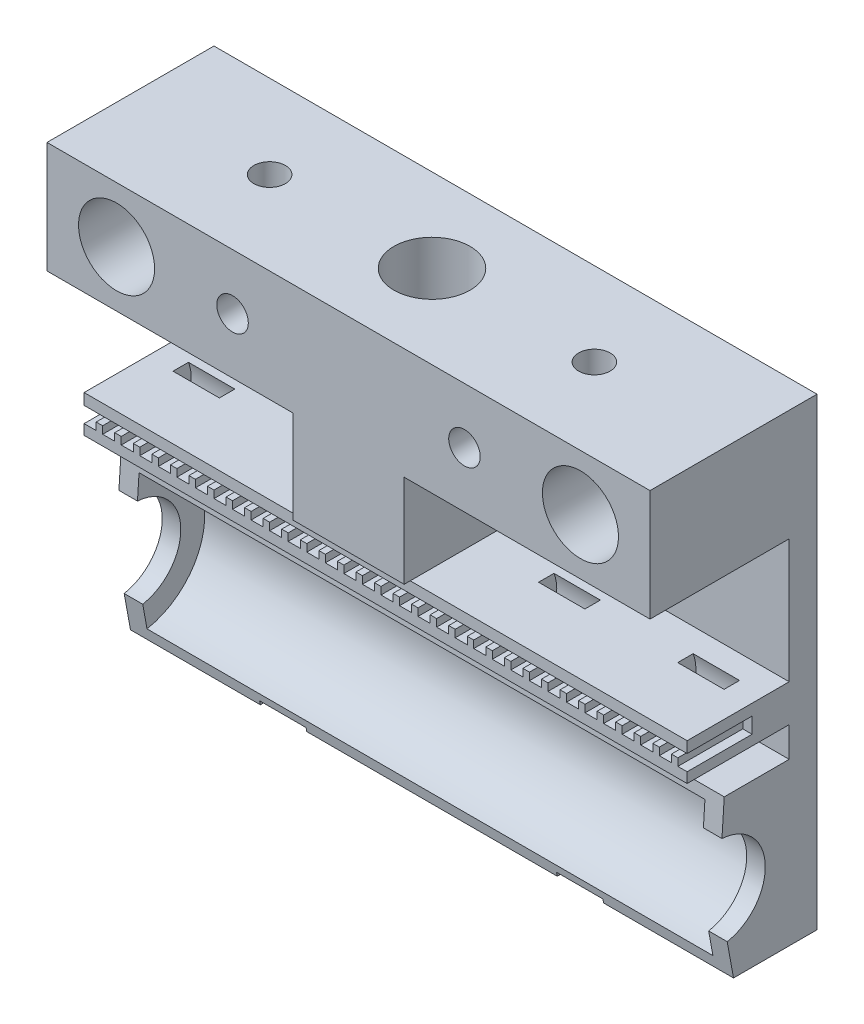
from build123d import *

# Parameters (mm, degrees)
SKIZZE1_W                       = 65
SKIZZE1_H                       = 50
AUFSATZ_LINEAR_AUSTRAGEN1_DEPTH = 3
SKIZZE2_W                       = 65
SKIZZE2_H                       = 12
AUFSATZ_LINEAR_AUSTRAGEN2_DEPTH = 15
SCHNITT_LINEAR_AUSTRAGEN1_REACH = 46.78
SKIZZE3_R                       = 4.1
SKIZZE3_R_2                     = 1.7
SCHNITT_LINEAR_AUSTRAGEN2_DEPTH = 3.5
AUFSATZ_LINEAR_AUSTRAGEN4_DEPTH = 65
AUFSATZ_LINEAR_AUSTRAGEN5_DEPTH = 2
SKIZZE12_W                      = 5
SKIZZE12_H                      = 1.5
SKIZZE14_W                      = 65
SKIZZE14_H                      = 4
AUFSATZ_LINEAR_AUSTRAGEN6_DEPTH = 4
SKIZZE15_W                      = 65
SKIZZE15_H                      = 1.2
SKIZZE15_H_2                    = 1.9
AUFSATZ_LINEAR_AUSTRAGEN7_DEPTH = 7
SCHNITT_LINEAR_AUSTRAGEN4_DEPTH = 7
SCHNITT_LINEAR_AUSTRAGEN5_REACH = 64.292
SKIZZE18_R                      = 1.7
SCHNITT_LINEAR_AUSTRAGEN6_DEPTH = 3.5
SKIZZE22_W                      = 5
SKIZZE22_H                      = 1.5
SCHNITT_ROTATION2_ANGLE         = 180
LINEARES_MUSTER1_COUNT          = 2
LINEARES_MUSTER1_PITCH          = 15
SPIEGELN5_COPY_1_SKETCH_W       = 5
SPIEGELN5_COPY_1_SKETCH_H       = 1.5
SPIEGELN5_COPY_1_ANGLE          = 180
SKIZZE25_W                      = 12
SKIZZE25_H                      = 10
AUFSATZ_LINEAR_AUSTRAGEN8_DEPTH = 15
SKIZZE23_R                      = 4.1
SCHNITT_LINEAR_AUSTRAGEN7_DEPTH = 20


with BuildPart() as part:
    # Skizze1 → Aufsatz-Linear austragen1 (new body)
    with BuildSketch(Plane.XY):
        Rectangle(SKIZZE1_W, SKIZZE1_H)
    extrude(amount=AUFSATZ_LINEAR_AUSTRAGEN1_DEPTH)

    # Skizze2 → Aufsatz-Linear austragen2 (add)
    with BuildSketch(Plane.XY.offset(3)):
        with Locations((0, 19)):
            Rectangle(SKIZZE2_W, SKIZZE2_H)
    extrude(amount=AUFSATZ_LINEAR_AUSTRAGEN2_DEPTH)

    # Skizze3 → Schnitt-Linear austragen1 (cut, up to next)
    with BuildSketch(Plane.XY.offset(18), mode=Mode.PRIVATE) as schnitt_linear_austragen1_sk1:
        with Locations((-25, 19)):
            Circle(SKIZZE3_R)
    schnitt_linear_austragen1_tool1 = extrude(schnitt_linear_austragen1_sk1.sketch, amount=-SCHNITT_LINEAR_AUSTRAGEN1_REACH, mode=Mode.PRIVATE) & part.part
    # Skizze3 → Schnitt-Linear austragen1 (cut, up to next)
    with BuildSketch(Plane.XY.offset(18), mode=Mode.PRIVATE) as schnitt_linear_austragen1_sk2:
        with Locations((25, 19)):
            Circle(SKIZZE3_R)
    schnitt_linear_austragen1_tool2 = extrude(schnitt_linear_austragen1_sk2.sketch, amount=-SCHNITT_LINEAR_AUSTRAGEN1_REACH, mode=Mode.PRIVATE) & part.part
    # Skizze3 → Schnitt-Linear austragen1 (cut, up to next)
    with BuildSketch(Plane.XY.offset(18), mode=Mode.PRIVATE) as schnitt_linear_austragen1_sk3:
        with Locations((-12.5, 19)):
            Circle(SKIZZE3_R_2)
    schnitt_linear_austragen1_tool3 = extrude(schnitt_linear_austragen1_sk3.sketch, amount=-SCHNITT_LINEAR_AUSTRAGEN1_REACH, mode=Mode.PRIVATE) & part.part
    # Skizze3 → Schnitt-Linear austragen1 (cut, up to next)
    with BuildSketch(Plane.XY.offset(18), mode=Mode.PRIVATE) as schnitt_linear_austragen1_sk4:
        with Locations((12.5, 19)):
            Circle(SKIZZE3_R_2)
    schnitt_linear_austragen1_tool4 = extrude(schnitt_linear_austragen1_sk4.sketch, amount=-SCHNITT_LINEAR_AUSTRAGEN1_REACH, mode=Mode.PRIVATE) & part.part
    add(schnitt_linear_austragen1_tool1.solids().sort_by_distance((-25, 19, 18))[0], mode=Mode.SUBTRACT)
    add(schnitt_linear_austragen1_tool2.solids().sort_by_distance((25, 19, 18))[0], mode=Mode.SUBTRACT)
    add(schnitt_linear_austragen1_tool3.solids().sort_by_distance((-12.5, 19, 18))[0], mode=Mode.SUBTRACT)
    add(schnitt_linear_austragen1_tool4.solids().sort_by_distance((12.5, 19, 18))[0], mode=Mode.SUBTRACT)

    # Skizze7 → Schnitt-Linear austragen2 (cut)
    with BuildSketch(Plane(origin=(0, 0, 0), x_dir=(-1, 0, 0), z_dir=(0, 0, -1))):
        Polygon((-9.209103466, 19), (-10.854551733, 21.85), (-14.145448267, 21.85), (-15.790896534, 19), (-14.145448267, 16.15), (-10.854551733, 16.15), align=None)
        Polygon((15.790896534, 19), (14.145448267, 21.85), (10.854551733, 21.85), (9.209103466, 19), (10.854551733, 16.15), (14.145448267, 16.15), align=None)
    extrude(amount=-SCHNITT_LINEAR_AUSTRAGEN2_DEPTH, mode=Mode.SUBTRACT)

    # Skizze10 → Aufsatz-Linear austragen4 (add)
    with BuildSketch(Plane.ZY.offset(-32.5)):
        with BuildLine():
            Line((3, -7.588730762), (3, -16.347460104))
            ThreePointArc((3, -16.347460104), (5.046008117, -11.169538344), (10.07877855, -8.788730762))
            Line((10.07877855, -8.788730762), (10, -7.588730762))
            Line((10, -7.588730762), (3, -7.588730762))
        make_face()
        with BuildLine():
            Line((3, -16.347460104), (3, -25))
            Line((3, -25), (9, -25))
            Line((9, -25), (9.218432971, -23.8))
            ThreePointArc((9.218432971, -23.8), (4.758789024, -21.20053283), (3, -16.347460104))
        make_face()
    extrude(amount=AUFSATZ_LINEAR_AUSTRAGEN4_DEPTH)

    # Skizze11 → Aufsatz-Linear austragen5 (add)
    with BuildSketch(Plane.ZY.offset(-32.5)):
        with BuildLine():
            Line((10, -7.588730762), (3, -7.588730762))
            Line((3, -7.588730762), (3, -25))
            Line((3, -25), (9, -25))
            Line((9, -25), (9.679576219, -21.266628352))
            ThreePointArc((9.679576219, -21.266628352), (5.583191864, -16.06136304), (10.247461089, -11.358199812))
            Line((10.247461089, -11.358199812), (10, -7.588730762))
        make_face()
    aufsatz_linear_austragen5 = extrude(amount=AUFSATZ_LINEAR_AUSTRAGEN5_DEPTH)

    # Spiegeln1: Aufsatz-Linear austragen5 across plane
    add(aufsatz_linear_austragen5.mirror(Plane(origin=(0, 0, 0), x_dir=(0, 0, 1), z_dir=(1, 0, 0))))

    # Skizze12 → Schnitt-Rotation1 (revolve, cut)
    with BuildSketch(Plane(origin=(0, 0.621105463, 9.46103417), x_dir=(1, 0, 0), z_dir=(0, 0.06550778213967619, 0.9978520584130399))):
        with Locations((-16, -7.880091511)):
            Rectangle(SKIZZE12_W, SKIZZE12_H)
    schnitt_rotation1 = revolve(axis=Axis((-30.5, -16.347460104, 10.575), (1, 0, 0)), mode=Mode.SUBTRACT)

    # Spiegeln2: Schnitt-Rotation1 across plane
    add(schnitt_rotation1.mirror(Plane(origin=(0, 0, 0), x_dir=(0, 0, 1), z_dir=(1, 0, 0))), mode=Mode.SUBTRACT)

    # Skizze14 → Aufsatz-Linear austragen6 (add)
    with BuildSketch(Plane.XY.offset(3)):
        with Locations((0, -2.347460104)):
            Rectangle(SKIZZE14_W, SKIZZE14_H)
    extrude(amount=AUFSATZ_LINEAR_AUSTRAGEN6_DEPTH)

    # Skizze15 → Aufsatz-Linear austragen7 (add)
    with BuildSketch(Plane.XY.offset(7)):
        with Locations((0, -0.947460104)):
            Rectangle(SKIZZE15_W, SKIZZE15_H)
        with Locations((0, -3.397460104)):
            Rectangle(SKIZZE15_W, SKIZZE15_H_2)
    extrude(amount=AUFSATZ_LINEAR_AUSTRAGEN7_DEPTH)

    # Skizze16 → Schnitt-Linear austragen4 (cut)
    with BuildSketch(Plane.XY.offset(14)):
        Polygon((-32.5, -3.247460104), (-31.2, -3.247460104), (-31.2, -2.447460104), (-30.5, -2.447460104), (-30.5, -3.247460104), (-29.2, -3.247460104), (-29.2, -2.447460104), (-28.5, -2.447460104), (-28.5, -3.247460104), (-27.2, -3.247460104), (-27.2, -2.447460104), (-26.5, -2.447460104), (-26.5, -3.247460104), (-25.2, -3.247460104), (-25.2, -2.447460104), (-24.5, -2.447460104), (-24.5, -3.247460104), (-23.2, -3.247460104), (-23.2, -2.447460104), (-22.5, -2.447460104), (-22.5, -3.247460104), (-21.2, -3.247460104), (-21.2, -2.447460104), (-20.5, -2.447460104), (-20.5, -3.247460104), (-19.2, -3.247460104), (-19.2, -2.447460104), (-18.5, -2.447460104), (-18.5, -3.247460104), (-17.2, -3.247460104), (-17.2, -2.447460104), (-16.5, -2.447460104), (-16.5, -3.247460104), (-15.2, -3.247460104), (-15.2, -2.447460104), (-14.5, -2.447460104), (-14.5, -3.247460104), (-13.2, -3.247460104), (-13.2, -2.447460104), (-12.5, -2.447460104), (-12.5, -3.247460104), (-11.2, -3.247460104), (-11.2, -2.447460104), (-10.5, -2.447460104), (-10.5, -3.247460104), (-9.2, -3.247460104), (-9.2, -2.447460104), (-8.5, -2.447460104), (-8.5, -3.247460104), (-7.2, -3.247460104), (-7.2, -2.447460104), (-6.5, -2.447460104), (-6.5, -3.247460104), (-5.2, -3.247460104), (-5.2, -2.447460104), (-4.5, -2.447460104), (-4.5, -3.247460104), (-3.2, -3.247460104), (-3.2, -2.447460104), (-2.5, -2.447460104), (-2.5, -3.247460104), (-1.2, -3.247460104), (-1.2, -2.447460104), (-0.5, -2.447460104), (-0.5, -3.247460104), (0.8, -3.247460104), (0.8, -2.447460104), (1.5, -2.447460104), (1.5, -3.247460104), (2.8, -3.247460104), (2.8, -2.447460104), (3.5, -2.447460104), (3.5, -3.247460104), (4.8, -3.247460104), (4.8, -2.447460104), (5.5, -2.447460104), (5.5, -3.247460104), (6.8, -3.247460104), (6.8, -2.447460104), (7.5, -2.447460104), (7.5, -3.247460104), (8.8, -3.247460104), (8.8, -2.447460104), (9.5, -2.447460104), (9.5, -3.247460104), (10.8, -3.247460104), (10.8, -2.447460104), (11.5, -2.447460104), (11.5, -3.247460104), (12.8, -3.247460104), (12.8, -2.447460104), (13.5, -2.447460104), (13.5, -3.247460104), (14.8, -3.247460104), (14.8, -2.447460104), (15.5, -2.447460104), (15.5, -3.247460104), (16.8, -3.247460104), (16.8, -2.447460104), (17.5, -2.447460104), (17.5, -3.247460104), (18.8, -3.247460104), (18.8, -2.447460104), (19.5, -2.447460104), (19.5, -3.247460104), (20.8, -3.247460104), (20.8, -2.447460104), (21.5, -2.447460104), (21.5, -3.247460104), (22.8, -3.247460104), (22.8, -2.447460104), (23.5, -2.447460104), (23.5, -3.247460104), (24.8, -3.247460104), (24.8, -2.447460104), (25.5, -2.447460104), (25.5, -3.247460104), (26.8, -3.247460104), (26.8, -2.447460104), (27.5, -2.447460104), (27.5, -3.247460104), (28.8, -3.247460104), (28.8, -2.447460104), (29.5, -2.447460104), (29.5, -3.247460104), (30.8, -3.247460104), (30.8, -2.447460104), (31.5, -2.447460104), (31.5, -3.247460104), (32.8, -3.247460104), (32.8, -2.397460104), (-32.5, -2.397460104), align=None)
    extrude(amount=-SCHNITT_LINEAR_AUSTRAGEN4_DEPTH, mode=Mode.SUBTRACT)

    # Skizze18 → Schnitt-Linear austragen5 (cut, up to next)
    with BuildSketch(Plane(origin=(0, 25, 0), x_dir=(1, 0, 0), z_dir=(0, 1, 0)), mode=Mode.PRIVATE) as schnitt_linear_austragen5_sk1:
        with Locations(Location((-17.5, -9, 0), (0, 0, 270))):
            Circle(SKIZZE18_R)
    schnitt_linear_austragen5_tool1 = extrude(schnitt_linear_austragen5_sk1.sketch, amount=-SCHNITT_LINEAR_AUSTRAGEN5_REACH, mode=Mode.PRIVATE) & part.part
    # Skizze18 → Schnitt-Linear austragen5 (cut, up to next)
    with BuildSketch(Plane(origin=(0, 25, 0), x_dir=(1, 0, 0), z_dir=(0, 1, 0)), mode=Mode.PRIVATE) as schnitt_linear_austragen5_sk2:
        with Locations(Location((17.5, -9, 0), (0, 0, 270))):
            Circle(SKIZZE18_R)
    schnitt_linear_austragen5_tool2 = extrude(schnitt_linear_austragen5_sk2.sketch, amount=-SCHNITT_LINEAR_AUSTRAGEN5_REACH, mode=Mode.PRIVATE) & part.part
    add(schnitt_linear_austragen5_tool1.solids().sort_by_distance((-17.5, 25, 9))[0], mode=Mode.SUBTRACT)
    add(schnitt_linear_austragen5_tool2.solids().sort_by_distance((17.5, 25, 9))[0], mode=Mode.SUBTRACT)

    # Skizze19 → Schnitt-Linear austragen6 (cut)
    with BuildSketch(Plane.XZ.offset(-13)):
        Polygon((-14.209103466, 9), (-15.854551733, 11.85), (-19.145448267, 11.85), (-20.790896534, 9), (-19.145448267, 6.15), (-15.854551733, 6.15), align=None)
    schnitt_linear_austragen6 = extrude(amount=-SCHNITT_LINEAR_AUSTRAGEN6_DEPTH, mode=Mode.SUBTRACT)

    # Spiegeln4: Schnitt-Linear austragen6 across plane
    add(schnitt_linear_austragen6.mirror(Plane(origin=(0, 0, 0), x_dir=(0, 0, 1), z_dir=(1, 0, 0))), mode=Mode.SUBTRACT)

    # Skizze22 → Schnitt-Rotation2 (revolve, cut)
    with BuildSketch(Plane.XY.offset(9.9)):
        with Locations((-27.2, 1.902539896)):
            Rectangle(SKIZZE22_W, SKIZZE22_H)
    schnitt_rotation2 = revolve(axis=Axis((-32.5, -1.997460104, 9.9), (-1, 0, 0)), revolution_arc=SCHNITT_ROTATION2_ANGLE, mode=Mode.SUBTRACT)

    # Lineares Muster1: Schnitt-Rotation2 ×2
    with Locations(*[(i * LINEARES_MUSTER1_PITCH, 0, 0) for i in range(1, LINEARES_MUSTER1_COUNT)]):
        add(schnitt_rotation2, mode=Mode.SUBTRACT)

    # Spiegeln5: Schnitt-Rotation2 across plane
    add(schnitt_rotation2.mirror(Plane(origin=(0, 0, 0), x_dir=(0, 0, 1), z_dir=(1, 0, 0))), mode=Mode.SUBTRACT)

    # Spiegeln5 copy 1 sketch → Spiegeln5 copy 1 (revolve, cut)
    with BuildSketch(Plane(origin=(-15, 0, 9.9), x_dir=(-1, 0, 0), z_dir=(0, 0, 1))):
        with Locations((-27.2, -1.902539896)):
            Rectangle(SPIEGELN5_COPY_1_SKETCH_W, SPIEGELN5_COPY_1_SKETCH_H)
    revolve(axis=Axis((17.5, -1.997460104, 9.9), (-1, 0, 0)), revolution_arc=SPIEGELN5_COPY_1_ANGLE, mode=Mode.SUBTRACT)

    # Skizze25 → Aufsatz-Linear austragen8 (add, through all)
    with BuildSketch(Plane.XY.offset(3)):
        with Locations((0, 8)):
            Rectangle(SKIZZE25_W, SKIZZE25_H)
    extrude(amount=AUFSATZ_LINEAR_AUSTRAGEN8_DEPTH)

    # Skizze23 → Schnitt-Linear austragen7 (cut)
    with BuildSketch(Plane(origin=(0, 25, 0), x_dir=(1, 0, 0), z_dir=(0, 1, 0))):
        with Locations(Location((0, -9, 0), (0, 0, 270))):
            Circle(SKIZZE23_R)
    extrude(amount=-SCHNITT_LINEAR_AUSTRAGEN7_DEPTH, mode=Mode.SUBTRACT)


solid = part.part
